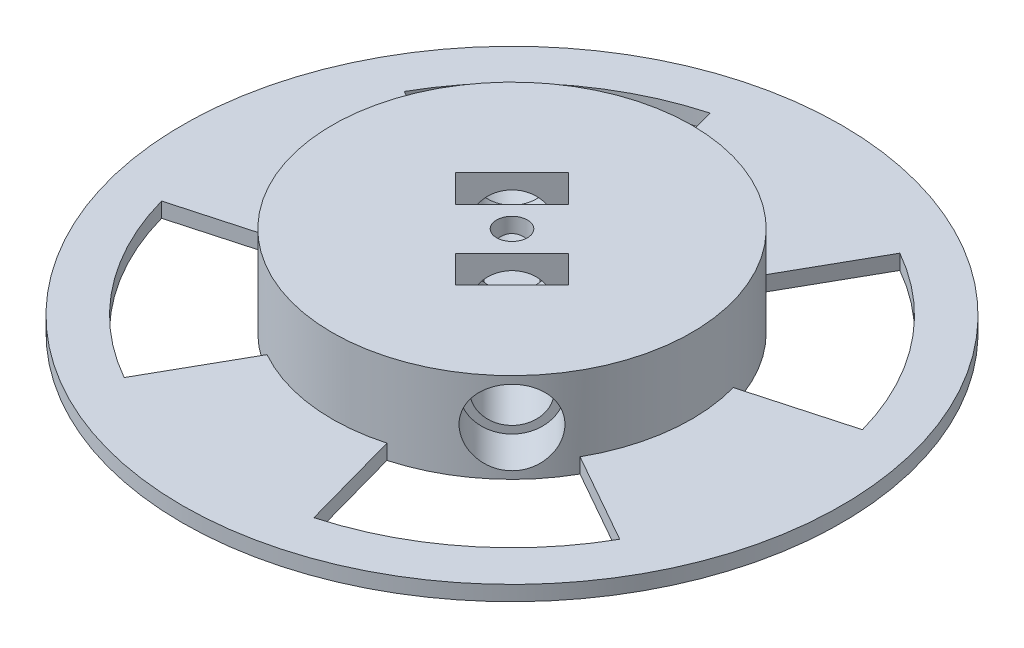
from build123d import *
from build123d.topology import SkipClean

# Parameters (mm, degrees)
SALIENTE_EXTRUIR4_DEPTH    = 6
CROQUIS10_R                = 1.03
SALIENTE_EXTRUIR5_DEPTH    = 3
CROQUIS10_3_R              = 1.03
CORTAR_EXTRUIR7_DEPTH      = 6
CORTAR_EXTRUIR8_REACH      = 20
CORTAR_EXTRUIR8_END_RADIUS = 12
CROQUIS11_R                = 2
CORTAR_EXTRUIR11_START     = 9
CROQUIS11_3_R              = 2.5
CORTAR_EXTRUIR11_DEPTH     = 10.000000167
CORTAR_EXTRUIR9_START      = 4.6
CORTAR_EXTRUIR9_DEPTH      = 2.6
CORTAR_EXTRUIR12_REACH     = 20
CORTAR_EXTRUIR10_START     = -3
CORTAR_EXTRUIR10_DEPTH     = 3
CORTAR_EXTRUIR13_START     = -9
CROQUIS11_5_R              = 2.5
CORTAR_EXTRUIR13_DEPTH     = 10.000000167
CORTAR_EXTRUIR14_START     = -2
CORTAR_EXTRUIR14_DEPTH     = 2.6
CORTAR_EXTRUIR15_START     = -3
CORTAR_EXTRUIR15_DEPTH     = 3
SALIENTE_EXTRUIR6_DEPTH    = 1
CORTAR_EXTRUIR17_DEPTH     = 2


with BuildPart() as part:
    # Croquis1 → Saliente-Extruir4 (new body)
    with BuildSketch(Plane(origin=(0, 0, 0), x_dir=(1, 0, 0), z_dir=(0, 1, 0))):
        with BuildLine():
            Line((0, -12), (0, 0))
            Line((0, 0), (-12, 0))
            ThreePointArc((-12, 0), (-8.485281374, -8.485281374), (0, -12))
        make_face()
        with BuildLine():
            Line((-12, 0), (0, 0))
            Line((0, 0), (0, 12))
            ThreePointArc((0, 12), (-8.485281374, 8.485281374), (-12, 0))
        make_face()
        with BuildLine():
            Line((0, 12), (0, 0))
            Line((0, 0), (12, 0))
            ThreePointArc((12, 0), (8.485281374, 8.485281374), (0, 12))
        make_face()
        with BuildLine():
            Line((12, 0), (0, 0))
            Line((0, 0), (0, -12))
            ThreePointArc((0, -12), (8.485281374, -8.485281374), (12, 0))
        make_face()
    extrude(amount=SALIENTE_EXTRUIR4_DEPTH)

    # Croquis10 → Saliente-Extruir5 (add)
    with BuildSketch(Plane(origin=(0, 0, 0), x_dir=(1, 0, 0), z_dir=(0, 1, 0))):
        Circle(CROQUIS10_R)
    extrude(amount=SALIENTE_EXTRUIR5_DEPTH)

    # Croquis10<3> → Cortar-Extruir7 (cut)
    with BuildSketch(Plane(origin=(0, 0, 0), x_dir=(1, 0, 0), z_dir=(0, 1, 0))):
        with Locations(Location((0, 0, 0), (0, 0, 270))):
            Circle(CROQUIS10_3_R)
    extrude(amount=CORTAR_EXTRUIR7_DEPTH, mode=Mode.SUBTRACT)

    # Cortar-Extruir8: up to this cylinder (the profile starts inside it)
    cortar_extruir8_end = Plane(origin=(0, 3, 0), z_dir=(0, -1, 0)) * Cylinder(CORTAR_EXTRUIR8_END_RADIUS, 65, mode=Mode.PRIVATE)
    # Croquis11 → Cortar-Extruir8 (cut, up to the surface)
    with BuildSketch(Plane(origin=(0, 0, 0), x_dir=(0.7071067811865477, 0, -0.7071067811865475), z_dir=(0.7071067811865475, 0, 0.7071067811865477)), mode=Mode.PRIVATE) as cortar_extruir8_sk1:
        with Locations(Location((0, 3, 0), (0, 0, 180))):
            Circle(CROQUIS11_R)
    cortar_extruir8_tool1 = extrude(cortar_extruir8_sk1.sketch, amount=CORTAR_EXTRUIR8_REACH, mode=Mode.PRIVATE) & cortar_extruir8_end
    add(cortar_extruir8_tool1.solids().sort_by_distance((0, 3, 0))[0], mode=Mode.SUBTRACT)

    # Croquis11<3> → Cortar-Extruir11 (cut, through all)
    with BuildSketch(Plane(origin=(0, 0, 0), x_dir=(0.7071067811865477, 0, -0.7071067811865475), z_dir=(0.7071067811865475, 0, 0.7071067811865477)).offset(CORTAR_EXTRUIR11_START)):
        with Locations(Location((0, 3, 0), (0, 0, 180))):
            Circle(CROQUIS11_3_R)
    extrude(amount=CORTAR_EXTRUIR11_DEPTH, mode=Mode.SUBTRACT)

    # Croquis14 → Cortar-Extruir9 (cut)
    with BuildSketch(Plane(origin=(0, 0, 0), x_dir=(0.7071067811865477, 0, -0.7071067811865475), z_dir=(0.7071067811865475, 0, 0.7071067811865477)).offset(CORTAR_EXTRUIR9_START)):
        Polygon((1.327905619, 5.3), (-1.327905619, 5.3), (-2.655811238, 3), (-1.327905619, 0.7), (1.327905619, 0.7), (2.655811238, 3), align=None)
    extrude(amount=-CORTAR_EXTRUIR9_DEPTH, mode=Mode.SUBTRACT)

    # Croquis11<4> → Cortar-Extruir12 (cut, up to next)
    with BuildSketch(Plane(origin=(0, 0, 0), x_dir=(0.7071067811865477, 0, -0.7071067811865475), z_dir=(0.7071067811865475, 0, 0.7071067811865477)), mode=Mode.PRIVATE) as cortar_extruir12_sk1:
        with BuildLine():
            ThreePointArc((2, 3), (1.414213562, 4.414213562), (0, 5))
            Line((0, 5), (0, 1))
            ThreePointArc((0, 1), (1.414213562, 1.585786438), (2, 3))
        make_face()
    cortar_extruir12_tool1 = extrude(cortar_extruir12_sk1.sketch, amount=-CORTAR_EXTRUIR12_REACH, mode=Mode.PRIVATE) & part.part
    # Croquis11<4> → Cortar-Extruir12 (cut, up to next)
    with BuildSketch(Plane(origin=(0, 0, 0), x_dir=(0.7071067811865477, 0, -0.7071067811865475), z_dir=(0.7071067811865475, 0, 0.7071067811865477)), mode=Mode.PRIVATE) as cortar_extruir12_sk2:
        with BuildLine():
            Line((0, 1), (0, 5))
            ThreePointArc((0, 5), (-2, 3), (0, 1))
        make_face()
    cortar_extruir12_tool2 = extrude(cortar_extruir12_sk2.sketch, amount=-CORTAR_EXTRUIR12_REACH, mode=Mode.PRIVATE) & part.part
    # Croquis11<4> → Cortar-Extruir12 (cut, up to next)
    with BuildSketch(Plane(origin=(0, 0, 0), x_dir=(0.7071067811865477, 0, -0.7071067811865475), z_dir=(0.7071067811865475, 0, 0.7071067811865477)), mode=Mode.PRIVATE) as cortar_extruir12_sk3:
        with BuildLine():
            ThreePointArc((2, 3), (1.414213562, 4.414213562), (0, 5))
            Line((0, 5), (0, 1))
            ThreePointArc((0, 1), (1.414213562, 1.585786438), (2, 3))
        make_face()
    cortar_extruir12_tool3 = extrude(cortar_extruir12_sk3.sketch, amount=-CORTAR_EXTRUIR12_REACH, mode=Mode.PRIVATE) & part.part
    # Croquis11<4> → Cortar-Extruir12 (cut, up to next)
    with BuildSketch(Plane(origin=(0, 0, 0), x_dir=(0.7071067811865477, 0, -0.7071067811865475), z_dir=(0.7071067811865475, 0, 0.7071067811865477)), mode=Mode.PRIVATE) as cortar_extruir12_sk4:
        with BuildLine():
            Line((0, 1), (0, 5))
            ThreePointArc((0, 5), (-2, 3), (0, 1))
        make_face()
    cortar_extruir12_tool4 = extrude(cortar_extruir12_sk4.sketch, amount=-CORTAR_EXTRUIR12_REACH, mode=Mode.PRIVATE) & part.part
    add(cortar_extruir12_tool1.solids().sort_by_distance((0.600211, 3, -0.600211))[0], mode=Mode.SUBTRACT)
    add(cortar_extruir12_tool2.solids().sort_by_distance((-0.600211, 3, 0.600211))[0], mode=Mode.SUBTRACT)
    add(cortar_extruir12_tool3.solids().sort_by_distance((0.600211, 3, -0.600211))[0], mode=Mode.SUBTRACT)
    add(cortar_extruir12_tool4.solids().sort_by_distance((-0.600211, 3, 0.600211))[0], mode=Mode.SUBTRACT)

    # Croquis16 → Cortar-Extruir10 (cut)
    with SkipClean():  # the faces are left unmerged after this step: merging them gives an invalid solid
        with BuildSketch(Plane(origin=(0, 6, 0), x_dir=(1, 0, 0), z_dir=(0, 1, 0)).offset(CORTAR_EXTRUIR10_START)):
            Polygon((-0.463728574, -3.292155699), (1.374749057, -5.13063333), (5.13063333, -1.374749057), (3.292155699, 0.463728574), align=None)
        extrude(amount=CORTAR_EXTRUIR10_DEPTH, mode=Mode.SUBTRACT)

    # Croquis11<5> → Cortar-Extruir13 (cut, through all)
    with BuildSketch(Plane(origin=(0, 0, 0), x_dir=(0.7071067811865477, 0, -0.7071067811865475), z_dir=(0.7071067811865475, 0, 0.7071067811865477)).offset(CORTAR_EXTRUIR13_START)):
        with Locations(Location((0, 3, 0), (0, 0, 180))):
            Circle(CROQUIS11_5_R)
    extrude(amount=-CORTAR_EXTRUIR13_DEPTH, mode=Mode.SUBTRACT)

    # Croquis14<2> → Cortar-Extruir14 (cut)
    with BuildSketch(Plane(origin=(0, 0, 0), x_dir=(0.7071067811865477, 0, -0.7071067811865475), z_dir=(0.7071067811865475, 0, 0.7071067811865477)).offset(CORTAR_EXTRUIR14_START)):
        Polygon((1.327905619, 5.3), (-1.327905619, 5.3), (-2.655811238, 3), (-1.327905619, 0.7), (1.327905619, 0.7), (2.655811238, 3), align=None)
    extrude(amount=-CORTAR_EXTRUIR14_DEPTH, mode=Mode.SUBTRACT)

    # Croquis18 → Cortar-Extruir15 (cut)
    with BuildSketch(Plane(origin=(0, 6, 0), x_dir=(1, 0, 0), z_dir=(0, 1, 0)).offset(CORTAR_EXTRUIR15_START)):
        Polygon((0.463728574, 3.292155699), (-3.292155699, -0.463728574), (-5.13063333, 1.374749057), (-1.374749057, 5.13063333), align=None)
    extrude(amount=CORTAR_EXTRUIR15_DEPTH, mode=Mode.SUBTRACT)

    # Croquis1<11> → Saliente-Extruir6 (add)
    with BuildSketch(Plane(origin=(0, 0, 0), x_dir=(1, 0, 0), z_dir=(0, 1, 0))):
        with BuildLine():
            Line((0, 19), (0, 12))
            ThreePointArc((0, 12), (8.485281374, 8.485281374), (12, 0))
            Line((12, 0), (19, 0))
            ThreePointArc((19, 0), (13.435028843, 13.435028843), (0, 19))
        make_face()
        with BuildLine():
            Line((0, 22), (0, 19))
            ThreePointArc((0, 19), (13.435028843, 13.435028843), (19, 0))
            Line((19, 0), (22, 0))
            ThreePointArc((22, 0), (15.556349186, 15.556349186), (0, 22))
        make_face()
        with BuildLine():
            Line((0, -22), (0, -19))
            ThreePointArc((0, -19), (-13.435028843, -13.435028843), (-19, 0))
            Line((-19, 0), (-22, 0))
            ThreePointArc((-22, 0), (-15.556349186, -15.556349186), (0, -22))
        make_face()
        with BuildLine():
            Line((0, -19), (0, -12))
            ThreePointArc((0, -12), (-8.485281374, -8.485281374), (-12, 0))
            Line((-12, 0), (-19, 0))
            ThreePointArc((-19, 0), (-13.435028843, -13.435028843), (0, -19))
        make_face()
        with BuildLine():
            Line((22, 0), (19, 0))
            ThreePointArc((19, 0), (13.435028843, -13.435028843), (0, -19))
            Line((0, -19), (0, -22))
            ThreePointArc((0, -22), (15.556349186, -15.556349186), (22, 0))
        make_face()
        with BuildLine():
            ThreePointArc((-19, 0), (-13.435028843, 13.435028843), (0, 19))
            Line((0, 19), (0, 22))
            ThreePointArc((0, 22), (-15.556349186, 15.556349186), (-22, 0))
            Line((-22, 0), (-19, 0))
        make_face()
        with BuildLine():
            Line((19, 0), (12, 0))
            ThreePointArc((12, 0), (8.485281374, -8.485281374), (0, -12))
            Line((0, -12), (0, -19))
            ThreePointArc((0, -19), (13.435028843, -13.435028843), (19, 0))
        make_face()
        with BuildLine():
            ThreePointArc((-12, 0), (-8.485281374, 8.485281374), (0, 12))
            Line((0, 12), (0, 19))
            ThreePointArc((0, 19), (-13.435028843, 13.435028843), (-19, 0))
            Line((-19, 0), (-12, 0))
        make_face()
    extrude(amount=SALIENTE_EXTRUIR6_DEPTH)

    # Croquis20 → Cortar-Extruir17 (cut)
    with SkipClean():  # the faces are left unmerged after this step: merging them gives an invalid solid
        with BuildSketch(Plane.XZ):
            with BuildLine():
                Line((5.085233412, 18.306840283), (3.211726365, 11.562214916))
                ThreePointArc((3.211726365, 11.562214916), (7.391916343, 9.453019242), (10.446754065, 5.90468708))
                Line((10.446754065, 5.90468708), (16.540693936, 9.349087877))
                ThreePointArc((16.540693936, 9.349087877), (11.703867543, 14.967280466), (5.085233412, 18.306840283))
            make_face()
            with BuildLine():
                Line((18.306840283, -5.085233412), (11.562214916, -3.211726365))
                ThreePointArc((11.562214916, -3.211726365), (9.453019242, -7.391916343), (5.90468708, -10.446754065))
                Line((5.90468708, -10.446754065), (9.349087877, -16.540693936))
                ThreePointArc((9.349087877, -16.540693936), (14.967280466, -11.703867543), (18.306840283, -5.085233412))
            make_face()
            with BuildLine():
                Line((-5.085233412, -18.306840283), (-3.211726365, -11.562214916))
                ThreePointArc((-3.211726365, -11.562214916), (-7.391916343, -9.453019242), (-10.446754065, -5.90468708))
                Line((-10.446754065, -5.90468708), (-16.540693936, -9.349087877))
                ThreePointArc((-16.540693936, -9.349087877), (-11.703867543, -14.967280466), (-5.085233412, -18.306840283))
            make_face()
            with BuildLine():
                Line((-18.306840283, 5.085233412), (-11.562214916, 3.211726365))
                ThreePointArc((-11.562214916, 3.211726365), (-9.453019242, 7.391916343), (-5.90468708, 10.446754065))
                Line((-5.90468708, 10.446754065), (-9.349087877, 16.540693936))
                ThreePointArc((-9.349087877, 16.540693936), (-14.967280466, 11.703867543), (-18.306840283, 5.085233412))
            make_face()
        extrude(amount=-CORTAR_EXTRUIR17_DEPTH, mode=Mode.SUBTRACT)


solid = part.part
